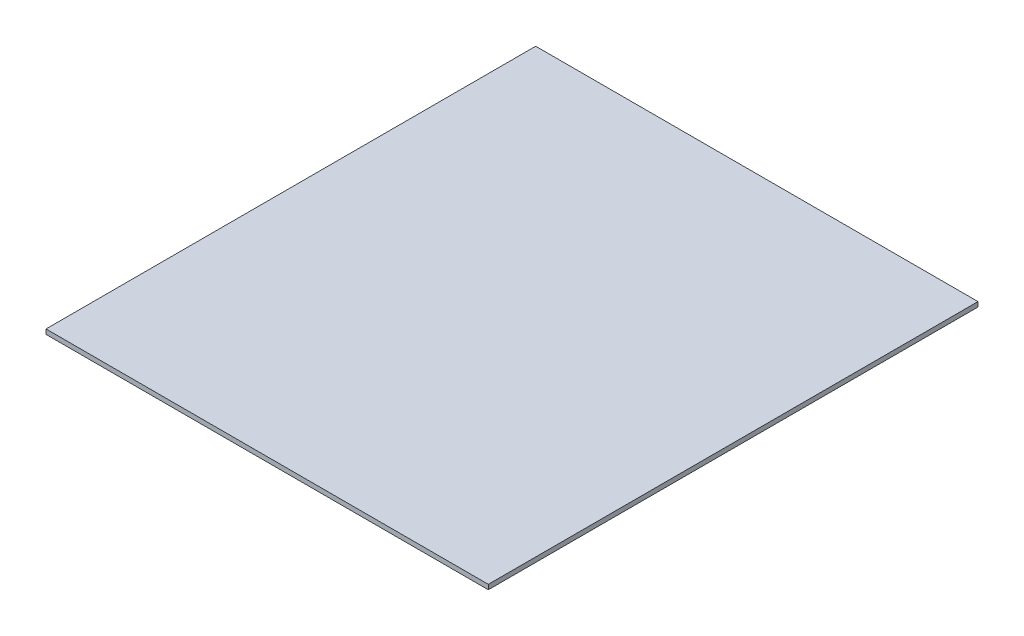
from build123d import *

# Parameters (mm, degrees)
SKETCH1_W           = 280
SKETCH1_H           = 310
BOSS_EXTRUDE1_DEPTH = 3


with BuildPart() as part:
    # Sketch1 → Boss-Extrude1 (new body)
    with BuildSketch(Plane(origin=(0, 0, 0), x_dir=(1, 0, 0), z_dir=(0, 1, 0))):
        Rectangle(SKETCH1_W, SKETCH1_H)
    extrude(amount=BOSS_EXTRUDE1_DEPTH)


solid = part.part
